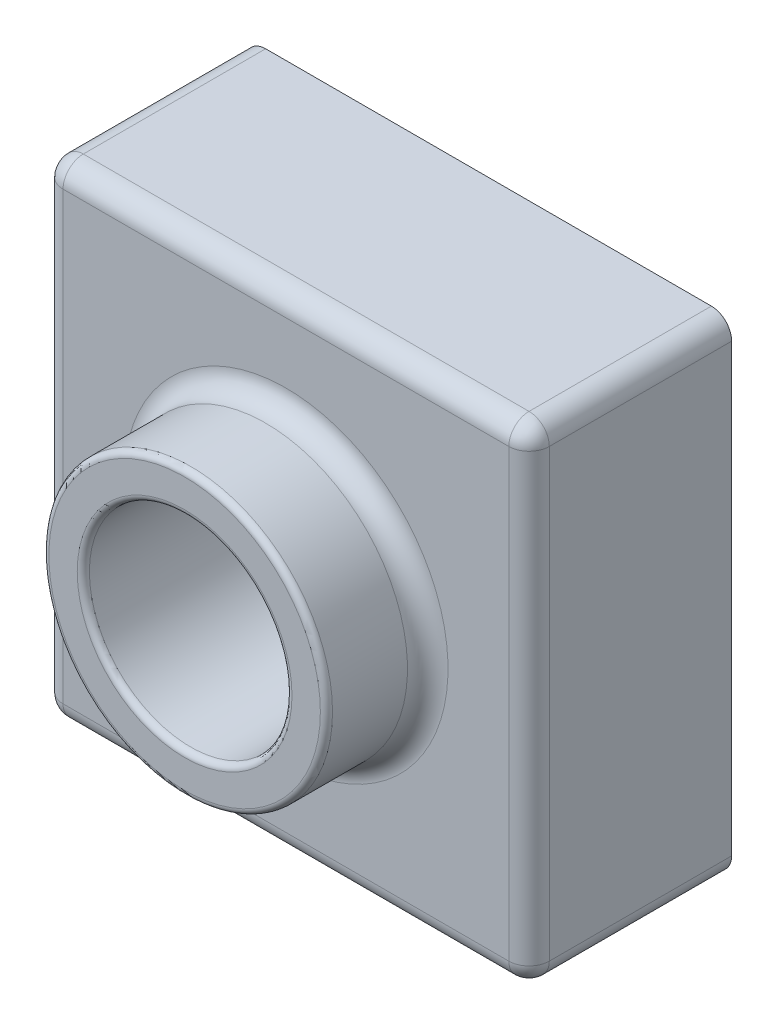
from build123d import *

# Parameters (mm, degrees)
SKETCH1_W               = 120
SKETCH1_H               = 120
BOSS_EXTRUDE1_DEPTH     = 50
SKETCH2_R               = 35
BOSS_EXTRUDE2_DEPTH     = 25
CUT_EXTRUDE1_DEPTH      = 186.539753153
CUT_EXTRUDE1_DEPTH_BACK = 186.539753153
SKETCH3_R               = 25
FILLET1_R               = 5
FILLET2_R               = 1.5
SHELL1_T                = -2


with BuildPart() as part:
    # Sketch1 → Boss-Extrude1 (new body)
    with BuildSketch(Plane.XY):
        with Locations((60, 60)):
            Rectangle(SKETCH1_W, SKETCH1_H)
    extrude(amount=BOSS_EXTRUDE1_DEPTH)

    # Sketch2 → Boss-Extrude2 (add)
    with BuildSketch(Plane.XY.offset(50)):
        with Locations((60, 60)):
            Circle(SKETCH2_R)
    extrude(amount=BOSS_EXTRUDE2_DEPTH)

    # Sketch3 → Cut-Extrude1 (cut, two sides: drawn at the far end of the back side and taken through both)
    with BuildSketch(Plane.XY.offset(75).offset(-CUT_EXTRUDE1_DEPTH_BACK)):
        with Locations((60, 60)):
            Circle(SKETCH3_R)
    extrude(amount=CUT_EXTRUDE1_DEPTH + CUT_EXTRUDE1_DEPTH_BACK, mode=Mode.SUBTRACT)

    # Fillet1
    fillet1_edges = [part.edges().sort_by_distance(p)[0] for p in [
        (120, 60, 50),
        (25, 60, 50),
        (60, 120, 50),
        (0, 60, 50),
        (0, 120, 25),
        (120, 120, 25),
        (120, 0, 25),
        (0, 0, 25),
        (60, 0, 50),
    ]]
    fillet(fillet1_edges, radius=FILLET1_R)

    # Fillet2
    fillet2_edges = [part.edges().sort_by_distance(p)[0] for p in [
        (25, 60, 75),
        (35, 60, 75),
    ]]
    fillet(fillet2_edges, radius=FILLET2_R)

    # Shell1
    shell1_openings = [part.faces().sort_by_distance(p)[0] for p in [
        (60, 1.697056275, 0),
    ]]
    offset(amount=SHELL1_T, openings=shell1_openings, kind=Kind.INTERSECTION)


solid = part.part
